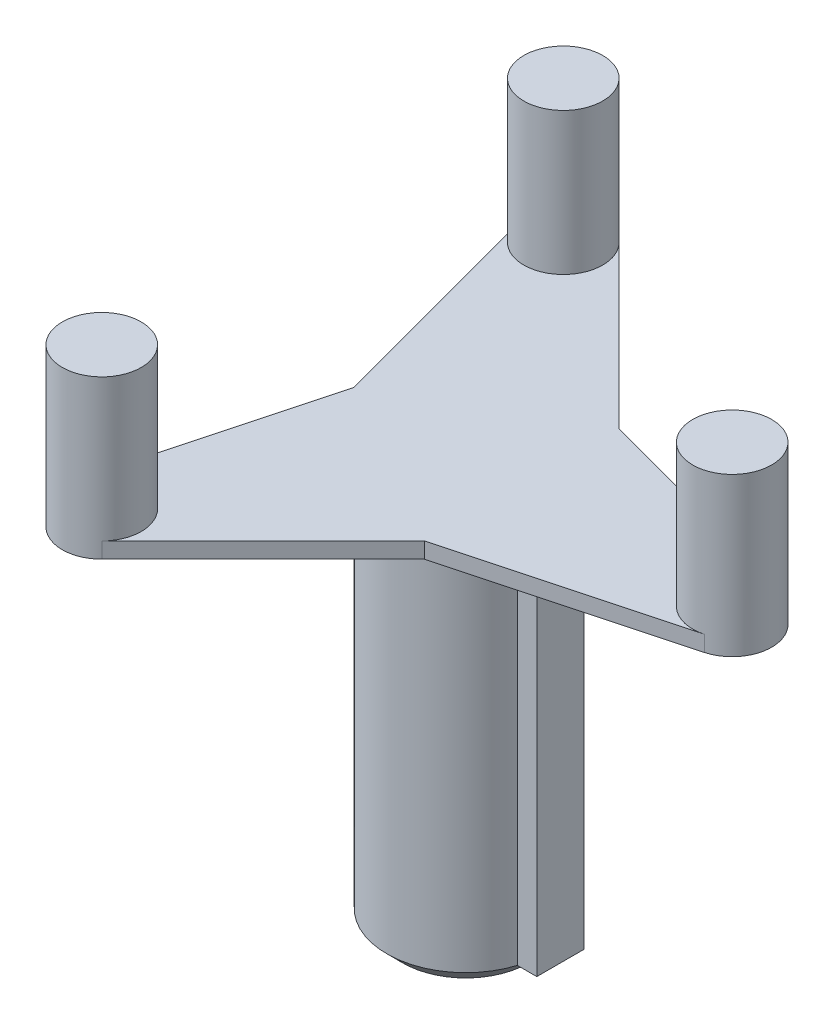
from build123d import *
from build123d.topology import SkipClean

# Parameters (mm, degrees)
SKETCH2_R             = 5
BOSS_EXTRUDE2_DEPTH   = 18
BOSS_EXTRUDE2_2_DEPTH = 18
BOSS_EXTRUDE2_3_DEPTH = 18
BOSS_EXTRUDE3_START   = -2
BOSS_EXTRUDE3_DEPTH   = 2
BOSS_EXTRUDE4_DEPTH   = 50
CHAMFER5_SIZE         = 2
SCALE1_SCALE          = 10


with BuildPart() as part:
    # Sketch2 → Boss-Extrude2 (new body)
    with BuildSketch(Plane(origin=(0, 0, 0), x_dir=(1, 0, 0), z_dir=(0, 1, 0))):
        with Locations((33.75, 0)):
            Circle(SKETCH2_R)
    extrude(amount=BOSS_EXTRUDE2_DEPTH)



with BuildPart() as body_2:
    # Sketch2 → Boss-Extrude2 2 (new body)
    with BuildSketch(Plane(origin=(0, 0, 0), x_dir=(1, 0, 0), z_dir=(0, 1, 0))):
        with Locations((-16.875, -29.228357378)):
            Circle(SKETCH2_R)
    extrude(amount=BOSS_EXTRUDE2_2_DEPTH)


with BuildPart() as body_3:
    # Sketch2 → Boss-Extrude2 3 (new body)
    with BuildSketch(Plane(origin=(0, 0, 0), x_dir=(1, 0, 0), z_dir=(0, 1, 0))):
        with Locations((-16.875, 29.228357378)):
            Circle(SKETCH2_R)
    extrude(amount=BOSS_EXTRUDE2_3_DEPTH)


with BuildPart() as part_1:
    with SkipClean():  # the faces are left unmerged after this step: merging them gives an invalid solid
        add(part.part)

        add(body_2.part)  # Boss-Extrude3 merges body 2

        add(body_3.part)  # Boss-Extrude3 merges body 3
        # Sketch5 → Boss-Extrude3 (add)
        with BuildSketch(Plane(origin=(0, 0, 0), x_dir=(1, 0, 0), z_dir=(0, 1, 0)).offset(BOSS_EXTRUDE3_START)):
            with BuildLine():
                Line((-13.339466094, 32.763891284), (7.109833073, 12.314592116))
                Line((7.109833073, 12.314592116), (35.044095226, 4.829629131))
                ThreePointArc((35.044095226, 4.829629131), (38.75, 0), (35.044095226, -4.829629131))
                Line((35.044095226, -4.829629131), (7.109833073, -12.314592116))
                Line((7.109833073, -12.314592116), (-13.339466094, -32.763891284))
                ThreePointArc((-13.339466094, -32.763891284), (-19.375, -33.558484397), (-21.704629131, -27.934262152))
                Line((-21.704629131, -27.934262152), (-14.219666147, 0))
                Line((-14.219666147, 0), (-21.704629131, 27.934262152))
                ThreePointArc((-21.704629131, 27.934262152), (-19.375, 33.558484397), (-13.339466094, 32.763891284))
            make_face()
        extrude(amount=BOSS_EXTRUDE3_DEPTH)

    # Sketch6 → Boss-Extrude4 (add)
    with SkipClean():  # the faces are left unmerged after this step: merging them gives an invalid solid
        with BuildSketch(Plane.XZ.offset(2)):
            with BuildLine():
                Line((9.539392014, -3), (12, -3))
                Line((12, -3), (12, 3))
                Line((12, 3), (9.539392014, 3))
                ThreePointArc((9.539392014, 3), (-10, 0), (9.539392014, -3))
            make_face()
        extrude(amount=BOSS_EXTRUDE4_DEPTH)

    # Chamfer5
    chamfer5_edges = [part_1.edges().sort_by_distance(p)[0] for p in [
        (10.769696007, -52, 3),
        (12, -52, 0),
        (10.769696007, -52, -3),
        (-10, -52, 0),
    ]]
    chamfer(chamfer5_edges, length=CHAMFER5_SIZE)


with BuildPart() as part_2:
    # Scale1: scaled about (0.288742854, -16.667261458, 0)
    add(part_1.part.scale(SCALE1_SCALE).moved(Location((-2.598685686, 150.005353122, 0))))


solid = part_2.part
